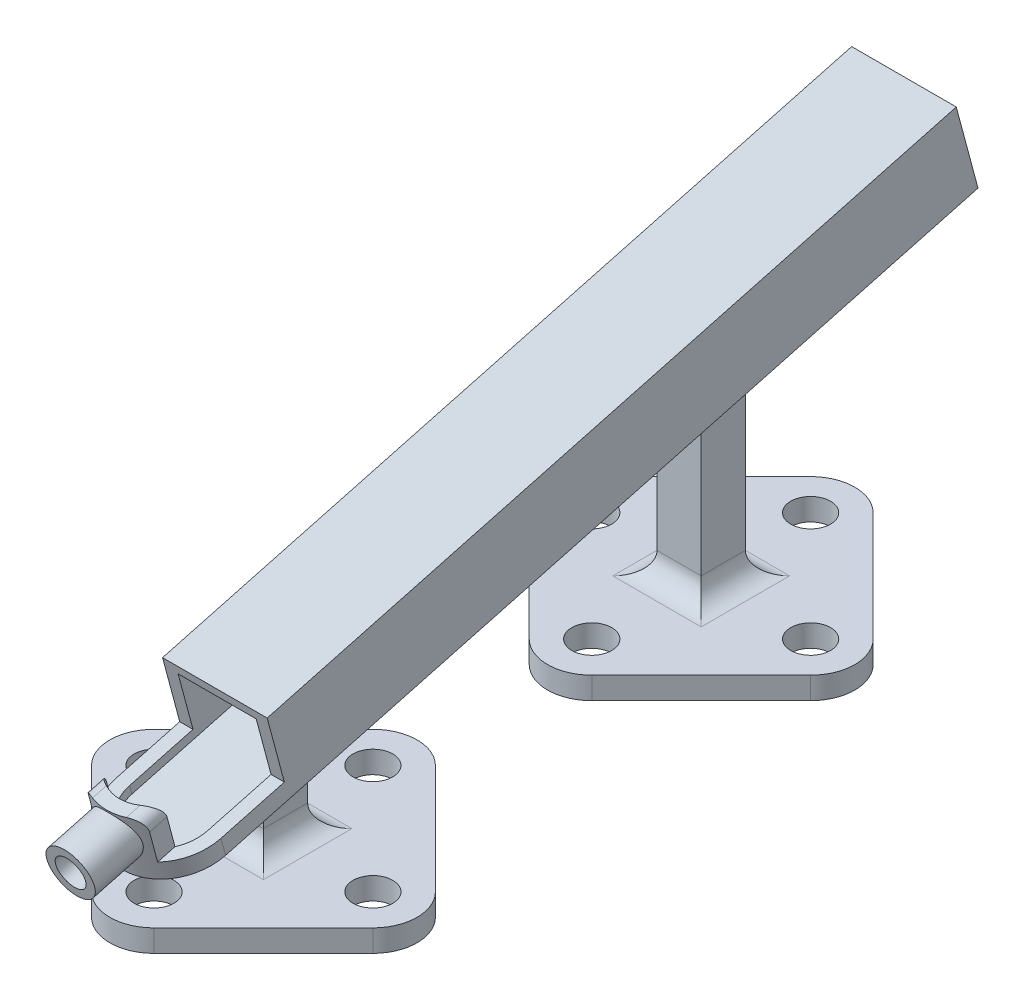
from build123d import *

# Parameters (mm, degrees)
SKETCH1_R                       = 4.5
BOSS_EXTRUDE1_DEPTH             = 2.5
SKETCH2_W                       = 10
SKETCH2_H                       = 45
BOSS_EXTRUDE2_DEPTH             = 5
CUT_EXTRUDE1_DEPTH              = 147.126229678
CUT_EXTRUDE1_DEPTH_BACK         = 147.126229678
BOSS_EXTRUDE3_DEPTH             = 11.83
FILLET1_R                       = 5
FILLET2_R                       = 5
CUT_EXTRUDE4_DEPTH              = 2
BOSS_EXTRUDE4_DEPTH             = 12
BOSS_EXTRUDE5_DEPTH             = 5
BOSS_EXTRUDE6_REACH             = 156.394
BOSS_EXTRUDE6_DIRECTION_2_REACH = 156.394
SKETCH9_W                       = 17.66
SKETCH9_H                       = 15
CUT_EXTRUDE5_DEPTH              = 173.103919267
SKETCH10_W                      = 10
SKETCH10_H                      = 29.66
CUT_EXTRUDE6_DEPTH              = 10
BOSS_EXTRUDE8_START             = -1.304369
SKETCH11_R                      = 5.4
SKETCH11_R_2                    = 3.4
BOSS_EXTRUDE8_DEPTH             = 11.304369
CUT_EXTRUDE7_REACH              = 198.188
SKETCH12_R                      = 3.4
FILLET3_R                       = 3
SKETCH13_W                      = 23.66
SKETCH13_H                      = 19
SKETCH13_W_2                    = 17.66
SKETCH13_H_2                    = 15
BOSS_EXTRUDE9_DEPTH             = 38


with BuildPart() as part:
    # Sketch1 → Boss-Extrude1 (new, symmetric)
    with BuildSketch(Plane(origin=(0, 0, 0), x_dir=(1, 0, 0), z_dir=(0, 1, 0))):
        with BuildLine():
            Line((-31.821067812, 7.071067812), (-7.071067812, 31.821067812))
            ThreePointArc((-7.071067812, 31.821067812), (0, 34.75), (7.071067812, 31.821067812))
            Line((7.071067812, 31.821067812), (31.821067812, 7.071067812))
            ThreePointArc((31.821067812, 7.071067812), (34.75, 0), (31.821067812, -7.071067812))
            Line((31.821067812, -7.071067812), (7.071067812, -31.821067812))
            ThreePointArc((7.071067812, -31.821067812), (0, -34.75), (-7.071067812, -31.821067812))
            Line((-7.071067812, -31.821067812), (-31.821067812, -7.071067812))
            ThreePointArc((-31.821067812, -7.071067812), (-34.75, 0), (-31.821067812, 7.071067812))
        make_face()
        with Locations(Location((0, 24.75, 0), (0, 0, 270))):
            Circle(SKETCH1_R, mode=Mode.SUBTRACT)
        with Locations(Location((24.75, 0, 0), (0, 0, 270))):
            Circle(SKETCH1_R, mode=Mode.SUBTRACT)
        with Locations(Location((0, -24.75, 0), (0, 0, 270))):
            Circle(SKETCH1_R, mode=Mode.SUBTRACT)
        with Locations(Location((-24.75, 0, 0), (0, 0, 270))):
            Circle(SKETCH1_R, mode=Mode.SUBTRACT)
    extrude(amount=BOSS_EXTRUDE1_DEPTH, both=True)


with BuildPart() as body_2:
    # Mirror3: mirrored copy
    add(part.part.mirror(Plane.XY.offset(49.5)))


with BuildPart() as body_3:
    # Sketch2 → Boss-Extrude2 (new, symmetric)
    with BuildSketch(Plane(origin=(0, 0, 0), x_dir=(0, 0, -1), z_dir=(1, 0, 0))):
        with Locations((-99, 25)):
            Rectangle(SKETCH2_W, SKETCH2_H)
    extrude(amount=BOSS_EXTRUDE2_DEPTH, both=True)


with BuildPart() as body_4:
    # Mirror5: mirrored copy
    add(body_3.part.mirror(Plane.XY.offset(49.5)))


with BuildPart() as cut_extrude1_tool:
    # Sketch3 → Cut-Extrude1 (new, two sides: drawn at the far end of the back side and taken through both)
    with BuildSketch(Plane(origin=(0, 0, 0), x_dir=(0, 0, -1), z_dir=(1, 0, 0)).offset(-CUT_EXTRUDE1_DEPTH_BACK)):
        Polygon((-398.060619113, -61.293305417), (-104, 17.5), (5, 46.706461975), (299.060619113, 125.499767392), (141.474008279, 713.621005618), (-555.647229947, 526.827932809), align=None)
    extrude(amount=CUT_EXTRUDE1_DEPTH + CUT_EXTRUDE1_DEPTH_BACK)


with BuildPart() as body_3_1:
    add(body_3.part)

    # Cut-Extrude1: cut by cut_extrude1_tool
    add(cut_extrude1_tool.part, mode=Mode.SUBTRACT)


with BuildPart() as body_4_1:
    add(body_4.part)

    # Cut-Extrude1: cut by cut_extrude1_tool
    add(cut_extrude1_tool.part, mode=Mode.SUBTRACT)

    # Combine2: union part
    add(part.part)

    # Fillet2
    fillet2_edges = [body_4_1.edges().sort_by_distance(p)[0] for p in [
        (-5, 2.5, 0),
        (0, 2.5, 5),
        (0, 2.5, -5),
        (5, 2.5, 0),
    ]]
    fillet(fillet2_edges, radius=FILLET2_R)



with BuildPart() as body_5:
    # Sketch4 → Boss-Extrude3 (new, symmetric)
    with BuildSketch(Plane(origin=(0, 0, 0), x_dir=(0, 0, -1), z_dir=(1, 0, 0))):
        Polygon((-130.821067812, 10.31331654), (14.067806131, 49.136173305), (13.550168041, 51.068024958), (-131.338705902, 12.245168192), align=None)
    extrude(amount=BOSS_EXTRUDE3_DEPTH, both=True)

    # Sketch5 → Cut-Extrude4 (cut)
    with BuildSketch(Plane(origin=(0, 44.259573936, 11.859317093), x_dir=(1, 0, 0), z_dir=(0, 0.9659258262890701, 0.25881904510251436))):
        with BuildLine():
            ThreePointArc((0, -123.694165284), (-8.365073221, -120.229238505), (-11.83, -111.864165284))
            Line((-11.83, -111.864165284), (-11.83, -123.694165284))
            Line((-11.83, -123.694165284), (0, -123.694165284))
        make_face()
        with BuildLine():
            Line((11.83, -123.694165284), (11.83, -111.864165284))
            ThreePointArc((11.83, -111.864165284), (8.365073221, -120.229238505), (0, -123.694165284))
            Line((0, -123.694165284), (11.83, -123.694165284))
        make_face()
    extrude(amount=-CUT_EXTRUDE4_DEPTH, mode=Mode.SUBTRACT)


with BuildPart() as body_2_1:
    add(body_2.part)

    # Combine1: union body 3
    add(body_3_1.part)

    # Fillet1
    fillet1_edges = [body_2_1.edges().sort_by_distance(p)[0] for p in [
        (0, 2.5, 94),
        (5, 2.5, 99),
        (-5, 2.5, 99),
        (0, 2.5, 104),
    ]]
    fillet(fillet1_edges, radius=FILLET1_R)



with BuildPart() as body_4_2:
    add(body_4_1.part)

    add(body_5.part)  # Boss-Extrude4 merges body 5
    # Sketch6 → Boss-Extrude4 (add)
    with BuildSketch(Plane(origin=(0, 44.259573936, 11.859317093), x_dir=(1, 0, 0), z_dir=(0, 0.9659258262890701, 0.25881904510251436))):
        with BuildLine():
            Line((11.83, -111.864165284), (11.83, 26.305834716))
            Line((11.83, 26.305834716), (-11.83, 26.305834716))
            Line((-11.83, 26.305834716), (-11.83, -111.864165284))
            ThreePointArc((-11.83, -111.864165284), (0, -123.694165284), (11.83, -111.864165284))
        make_face()
        with BuildLine():
            Line((8.83, -111.864165284), (8.83, 23.305834716))
            Line((8.83, 23.305834716), (-8.83, 23.305834716))
            Line((-8.83, 23.305834716), (-8.83, -111.864165284))
            ThreePointArc((-8.83, -111.864165284), (0, -120.694165284), (8.83, -111.864165284))
        make_face(mode=Mode.SUBTRACT)
    extrude(amount=BOSS_EXTRUDE4_DEPTH)

    # Sketch7 → Boss-Extrude5 (add)
    with BuildSketch(Plane(origin=(0, 55.850683851, 14.965145635), x_dir=(1, 0, 0), z_dir=(0, 0.9659258262890701, 0.25881904510251436))):
        Polygon((-11.83, -97.034165284), (-8.83, -97.034165284), (-8.83, 23.305834716), (8.83, 23.305834716), (8.83, -97.034165284), (11.83, -97.034165284), (11.83, 26.305834716), (-11.83, 26.305834716), align=None)
    extrude(amount=BOSS_EXTRUDE5_DEPTH)

    # Sketch8 → Boss-Extrude6 (add, up to next)
    with BuildSketch(Plane(origin=(0, 0, 0), x_dir=(0, 0, -1), z_dir=(1, 0, 0)), mode=Mode.PRIVATE) as boss_extrude6_sk1:
        Polygon((-109.98704714, 35.566022982), (-109.46940905, 33.634171329), (9.667882365, 65.556912352), (9.150244275, 67.488764005), align=None)
    boss_extrude6_tool1 = extrude(boss_extrude6_sk1.sketch, amount=BOSS_EXTRUDE6_REACH, mode=Mode.PRIVATE) - body_4_2.part
    add(boss_extrude6_tool1.solids().sort_by_distance((0, 50.561468, 50.159582))[0])

    # Sketch8 → Boss-Extrude6 direction 2 (add, up to next)
    with BuildSketch(Plane(origin=(0, 0, 0), x_dir=(0, 0, -1), z_dir=(1, 0, 0)), mode=Mode.PRIVATE) as boss_extrude6_direction_2_sk1:
        Polygon((-109.98704714, 35.566022982), (-109.46940905, 33.634171329), (9.667882365, 65.556912352), (9.150244275, 67.488764005), align=None)
    boss_extrude6_direction_2_tool1 = extrude(boss_extrude6_direction_2_sk1.sketch, amount=-BOSS_EXTRUDE6_DIRECTION_2_REACH, mode=Mode.PRIVATE) - body_4_2.part
    add(boss_extrude6_direction_2_tool1.solids().sort_by_distance((0, 50.561468, 50.159582))[0])

    # Sketch9 → Cut-Extrude5 (cut, through all)
    with BuildSketch(Plane(origin=(0, 6.031993887, -22.511707656), x_dir=(1, 0, 0), z_dir=(0, -0.25881904510251436, 0.9659258262890701))):
        with Locations((0, 53.320882651)):
            Rectangle(SKETCH9_W, SKETCH9_H)
    extrude(amount=-CUT_EXTRUDE5_DEPTH, mode=Mode.SUBTRACT)

    # Sketch10 → Cut-Extrude6 (cut)
    with BuildSketch(Plane(origin=(0, 55.850683851, 14.965145635), x_dir=(1, 0, 0), z_dir=(0, 0.96592582628907, 0.25881904510251436))):
        with Locations((-11.83, -111.864165284)):
            Rectangle(SKETCH10_W, SKETCH10_H)
    cut_extrude6 = extrude(amount=-CUT_EXTRUDE6_DEPTH, mode=Mode.SUBTRACT)

    # Mirror6: Cut-Extrude6 across plane
    add(cut_extrude6.mirror(Plane(origin=(0, 0, 0), x_dir=(0, 0, 1), z_dir=(1, 0, 0))), mode=Mode.SUBTRACT)


with BuildPart() as body_2_2:
    add(body_2_1.part)

    add(body_4_2.part)  # Boss-Extrude8 merges body 4
    # Sketch11 → Boss-Extrude8 (add)
    with BuildSketch(Plane(origin=(0, -32.014405743, 119.479388809), x_dir=(1, 0, 0), z_dir=(0, -0.25881904510251436, 0.96592582628907)).offset(BOSS_EXTRUDE8_START)):
        with Locations(Location((0, 52.020882651, 0), (0, 0, 270))):
            Circle(SKETCH11_R)
        with Locations(Location((0, 52.020882651, 0), (0, 0, 90))):
            Circle(SKETCH11_R_2, mode=Mode.SUBTRACT)
    extrude(amount=BOSS_EXTRUDE8_DEPTH)

    # Sketch12 → Cut-Extrude7 (cut, up to next)
    with BuildSketch(Plane(origin=(0, -34.602596194, 129.138647072), x_dir=(1, 0, 0), z_dir=(0, -0.25881904510251436, 0.96592582628907)), mode=Mode.PRIVATE) as cut_extrude7_sk1:
        with Locations(Location((0, 52.020882651, 0), (0, 0, 270))):
            Circle(SKETCH12_R)
    cut_extrude7_tool1 = extrude(cut_extrude7_sk1.sketch, amount=-CUT_EXTRUDE7_REACH, mode=Mode.PRIVATE) & body_2_2.part
    add(cut_extrude7_tool1.solids().sort_by_distance((0, 15.645718, 142.602642))[0], mode=Mode.SUBTRACT)

    # Fillet3
    fillet3_edges = [body_2_2.edges().sort_by_distance(p)[0] for p in [
        (6.83, 24.923884918, 130.385530569),
        (-6.83, 24.923884918, 130.385530569),
    ]]
    fillet(fillet3_edges, radius=FILLET3_R)

    # Sketch13 → Boss-Extrude9 (add)
    with BuildSketch(Plane(origin=(0, 6.808451022, -25.409485135), x_dir=(-1, 0, 0), z_dir=(0, 0.2588190451025156, -0.9659258262890698))):
        with Locations((0, 53.320882651)):
            Rectangle(SKETCH13_W, SKETCH13_H)
        with Locations((0, 53.320882651)):
            Rectangle(SKETCH13_W_2, SKETCH13_H_2, mode=Mode.SUBTRACT)
    extrude(amount=BOSS_EXTRUDE9_DEPTH)


solid = body_2_2.part
